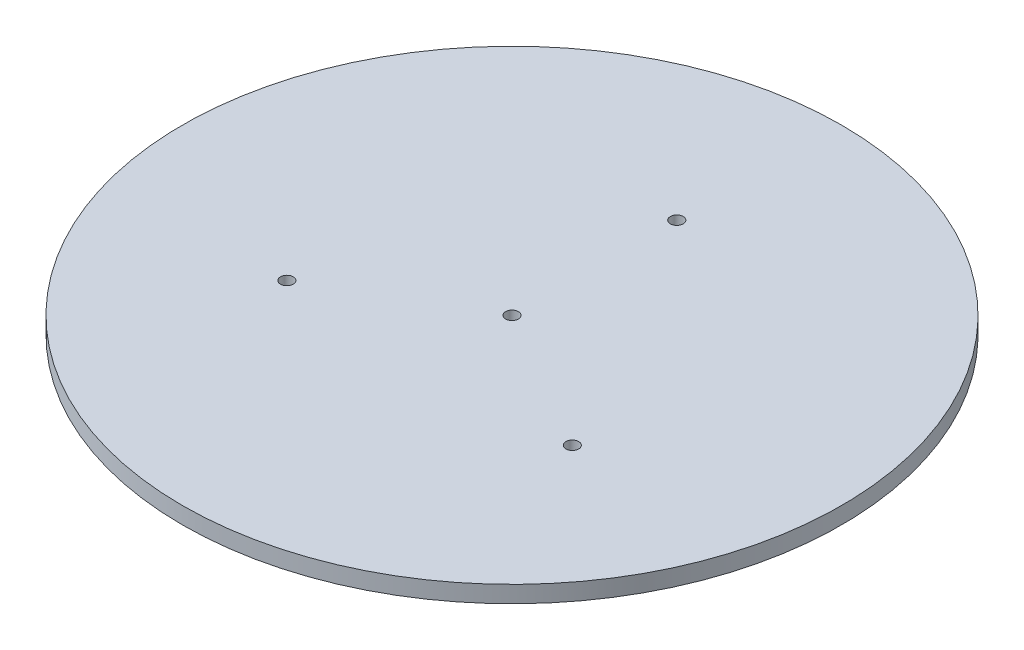
from build123d import *

# Parameters (mm, degrees)
SKETCH1_R           = 124.61875
SKETCH1_R_2         = 2.4257
BOSS_EXTRUDE1_DEPTH = 6.35


with BuildPart() as part:
    # Sketch1 → Boss-Extrude1 (new body)
    with BuildSketch(Plane(origin=(0, 0, 0), x_dir=(1, 0, 0), z_dir=(0, 1, 0))):
        with Locations(Location((0, 0, 0), (0, 0, 270))):
            Circle(SKETCH1_R)
        with Locations(Location((0, 62.309375, 0), (0, 0, 270))):
            Circle(SKETCH1_R_2, mode=Mode.SUBTRACT)
        with Locations(Location((53.961501644, -31.1546875, 0), (0, 0, 270))):
            Circle(SKETCH1_R_2, mode=Mode.SUBTRACT)
        with Locations(Location((-53.961501644, -31.1546875, 0), (0, 0, 270))):
            Circle(SKETCH1_R_2, mode=Mode.SUBTRACT)
        with Locations(Location((0, 0, 0), (0, 0, 270))):
            Circle(SKETCH1_R_2, mode=Mode.SUBTRACT)
    extrude(amount=BOSS_EXTRUDE1_DEPTH)


solid = part.part
